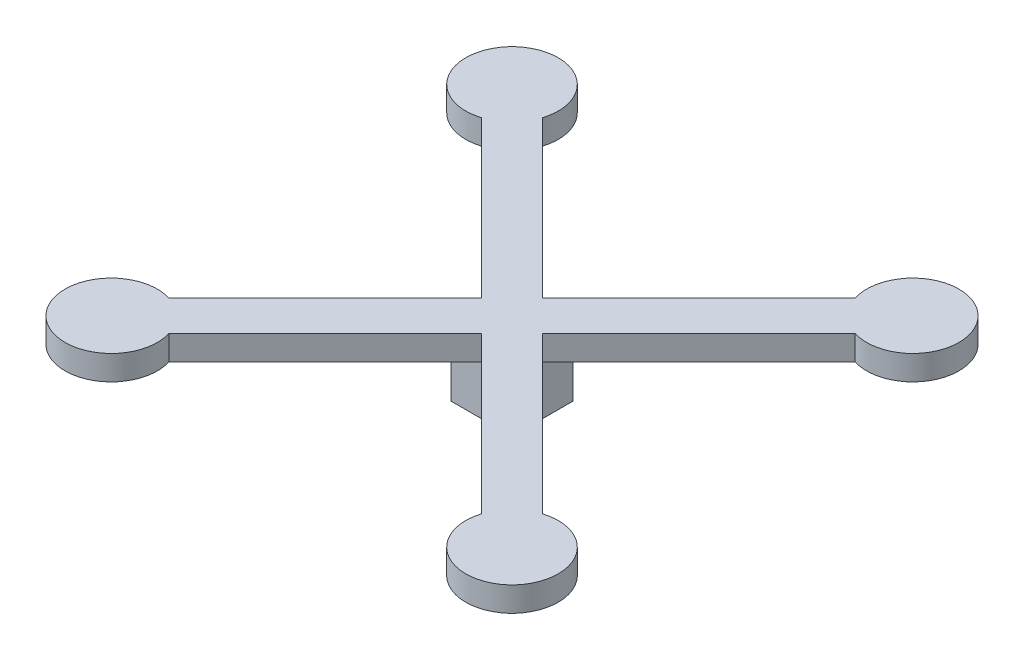
from build123d import *

# Parameters (mm, degrees)
BOSS_EXTRUDE1_DEPTH = 20
SKETCH2_W           = 49.497474684
SKETCH2_H           = 49.497474684
BOSS_EXTRUDE2_DEPTH = 40


with BuildPart() as part:
    # Sketch1 → Boss-Extrude1 (new body)
    with BuildSketch(Plane(origin=(0, 0, 0), x_dir=(1, 0, 0), z_dir=(0, 1, 0))):
        with BuildLine():
            ThreePointArc((-126.808112203, -151.556849545), (-136.118055378, -136.118055378), (-151.556849545, -126.808112203))
            Line((-151.556849545, -126.808112203), (-175.008928344, -150.260191002))
            Line((-175.008928344, -150.260191002), (-150.260191002, -175.008928344))
            Line((-150.260191002, -175.008928344), (-126.808112203, -151.556849545))
        make_face()
        with BuildLine():
            Line((-175.008928344, -150.260191002), (-151.556849545, -126.808112203))
            ThreePointArc((-151.556849545, -126.808112203), (-192.814554121, -184.892545545), (-125.134559673, -162.634559673))
            ThreePointArc((-125.134559673, -162.634559673), (-125.555308196, -157.032853688), (-126.808112203, -151.556849545))
            Line((-126.808112203, -151.556849545), (-150.260191002, -175.008928344))
            Line((-150.260191002, -175.008928344), (-175.008928344, -150.260191002))
        make_face()
        with BuildLine():
            Line((-12.374368671, -12.374368671), (-24.748737342, 0))
            Line((-24.748737342, 0), (-151.556849545, -126.808112203))
            ThreePointArc((-151.556849545, -126.808112203), (-136.118055378, -136.118055378), (-126.808112203, -151.556849545))
            Line((-126.808112203, -151.556849545), (0, -24.748737342))
            Line((0, -24.748737342), (-12.374368671, -12.374368671))
        make_face()
        with BuildLine():
            ThreePointArc((-151.556849545, 126.808112203), (-136.118055378, 136.118055378), (-126.808112203, 151.556849545))
            Line((-126.808112203, 151.556849545), (-150.260191002, 175.008928344))
            Line((-150.260191002, 175.008928344), (-175.008928344, 150.260191002))
            Line((-175.008928344, 150.260191002), (-151.556849545, 126.808112203))
        make_face()
        with BuildLine():
            Line((-150.260191002, 175.008928344), (-126.808112203, 151.556849545))
            ThreePointArc((-126.808112203, 151.556849545), (-125.555308196, 157.032853688), (-125.134559673, 162.634559673))
            ThreePointArc((-125.134559673, 162.634559673), (-192.814554121, 184.892545545), (-151.556849545, 126.808112203))
            Line((-151.556849545, 126.808112203), (-175.008928344, 150.260191002))
            Line((-175.008928344, 150.260191002), (-150.260191002, 175.008928344))
        make_face()
        with BuildLine():
            Line((-24.748737342, 0), (-12.374368671, 12.374368671))
            Line((-12.374368671, 12.374368671), (0, 24.748737342))
            Line((0, 24.748737342), (-126.808112203, 151.556849545))
            ThreePointArc((-126.808112203, 151.556849545), (-136.118055378, 136.118055378), (-151.556849545, 126.808112203))
            Line((-151.556849545, 126.808112203), (-24.748737342, 0))
        make_face()
        with BuildLine():
            Line((126.808112203, 151.556849545), (0, 24.748737342))
            Line((0, 24.748737342), (12.374368671, 12.374368671))
            Line((12.374368671, 12.374368671), (24.748737342, 0))
            Line((24.748737342, 0), (151.556849545, 126.808112203))
            ThreePointArc((151.556849545, 126.808112203), (136.118055378, 136.118055378), (126.808112203, 151.556849545))
        make_face()
        with BuildLine():
            ThreePointArc((200.134559673, 162.634559673), (157.032853688, 199.713811149), (126.808112203, 151.556849545))
            Line((126.808112203, 151.556849545), (150.260191002, 175.008928344))
            Line((150.260191002, 175.008928344), (175.008928344, 150.260191002))
            Line((175.008928344, 150.260191002), (151.556849545, 126.808112203))
            ThreePointArc((151.556849545, 126.808112203), (184.892545545, 132.454565224), (200.134559673, 162.634559673))
        make_face()
        with BuildLine():
            Line((150.260191002, 175.008928344), (126.808112203, 151.556849545))
            ThreePointArc((126.808112203, 151.556849545), (136.118055378, 136.118055378), (151.556849545, 126.808112203))
            Line((151.556849545, 126.808112203), (175.008928344, 150.260191002))
            Line((175.008928344, 150.260191002), (150.260191002, 175.008928344))
        make_face()
        with BuildLine():
            Line((24.748737342, 0), (12.374368671, -12.374368671))
            Line((12.374368671, -12.374368671), (0, -24.748737342))
            Line((0, -24.748737342), (126.808112203, -151.556849545))
            ThreePointArc((126.808112203, -151.556849545), (136.118055378, -136.118055378), (151.556849545, -126.808112203))
            Line((151.556849545, -126.808112203), (24.748737342, 0))
        make_face()
        with BuildLine():
            ThreePointArc((200.134559673, -162.634559673), (184.892545545, -132.454565224), (151.556849545, -126.808112203))
            Line((151.556849545, -126.808112203), (175.008928344, -150.260191002))
            Line((175.008928344, -150.260191002), (150.260191002, -175.008928344))
            Line((150.260191002, -175.008928344), (126.808112203, -151.556849545))
            ThreePointArc((126.808112203, -151.556849545), (157.032853688, -199.713811149), (200.134559673, -162.634559673))
        make_face()
        with BuildLine():
            Line((175.008928344, -150.260191002), (151.556849545, -126.808112203))
            ThreePointArc((151.556849545, -126.808112203), (136.118055378, -136.118055378), (126.808112203, -151.556849545))
            Line((126.808112203, -151.556849545), (150.260191002, -175.008928344))
            Line((150.260191002, -175.008928344), (175.008928344, -150.260191002))
        make_face()
        Polygon((12.374368671, 12.374368671), (0, 0), (12.374368671, -12.374368671), (24.748737342, 0), align=None)
        Polygon((12.374368671, -12.374368671), (0, 0), (-12.374368671, -12.374368671), (0, -24.748737342), align=None)
        Polygon((0, 0), (-12.374368671, 12.374368671), (-24.748737342, 0), align=None)
        Polygon((0, 24.748737342), (-12.374368671, 12.374368671), (0, 0), (12.374368671, 12.374368671), align=None)
        Polygon((-12.374368671, -12.374368671), (0, 0), (-24.748737342, 0), align=None)
    extrude(amount=BOSS_EXTRUDE1_DEPTH)

    # Sketch2 → Boss-Extrude2 (add)
    with BuildSketch(Plane.XZ):
        Rectangle(SKETCH2_W, SKETCH2_H)
    extrude(amount=BOSS_EXTRUDE2_DEPTH)


solid = part.part
